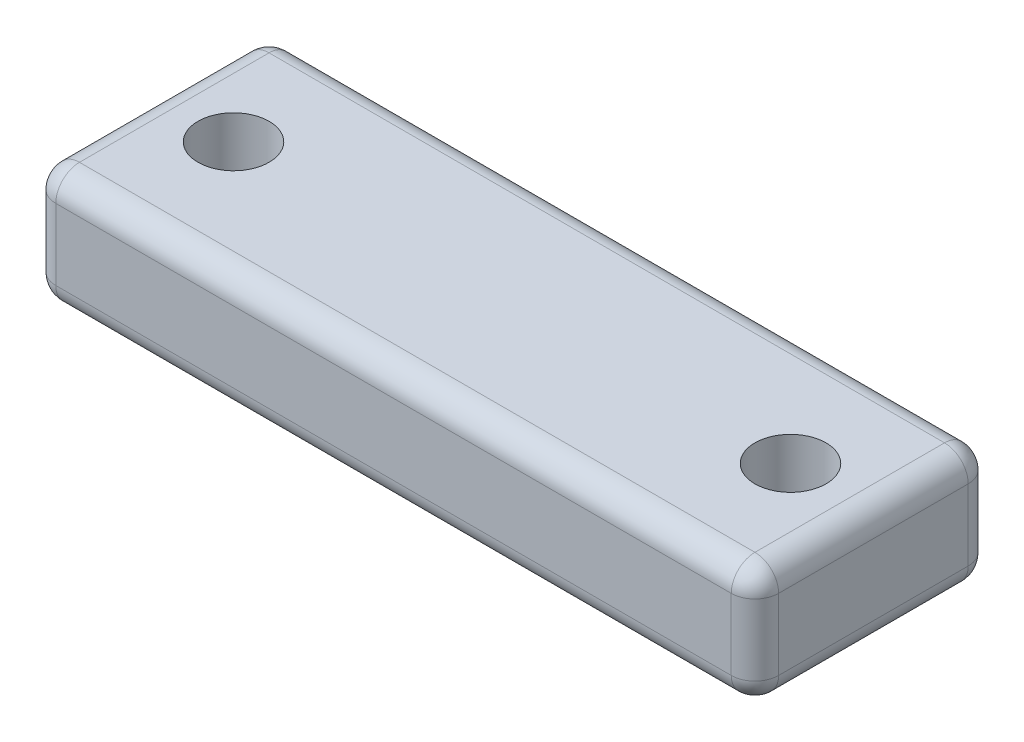
from build123d import *

# Parameters (mm, degrees)
SKETCH1_W               = 30.5
SKETCH1_H               = 10
BOSS_EXTRUDE1_DEPTH     = 5
CUT_EXTRUDE1_DEPTH      = 33.484611742
CUT_EXTRUDE1_DEPTH_BACK = 33.484611742
SKETCH2_R               = 1.5
FILLET1_R               = 1


with BuildPart() as part:
    # Sketch1 → Boss-Extrude1 (new body)
    with BuildSketch(Plane(origin=(0, 0, 0), x_dir=(1, 0, 0), z_dir=(0, 1, 0))):
        with Locations((-15.25, 5)):
            Rectangle(SKETCH1_W, SKETCH1_H)
    extrude(amount=BOSS_EXTRUDE1_DEPTH)

    # Sketch2 → Cut-Extrude1 (cut, two sides: drawn at the far end of the back side and taken through both)
    with BuildSketch(Plane(origin=(0, 5, 0), x_dir=(1, 0, 0), z_dir=(0, 1, 0)).offset(-CUT_EXTRUDE1_DEPTH_BACK)):
        with Locations(Location((-27, 5, 0), (0, 0, 270))):
            Circle(SKETCH2_R)
        with Locations(Location((-3.5, 5, 0), (0, 0, 270))):
            Circle(SKETCH2_R)
    extrude(amount=CUT_EXTRUDE1_DEPTH + CUT_EXTRUDE1_DEPTH_BACK, mode=Mode.SUBTRACT)

    # Fillet1
    fillet1_edges = [part.edges().sort_by_distance(p)[0] for p in [
        (-30.5, 5, -5),
        (-15.25, 5, 0),
        (0, 5, -5),
        (-15.25, 0, 0),
        (-30.5, 0, -5),
        (-15.25, 0, -10),
        (0, 0, -5),
        (0, 2.5, 0),
        (-30.5, 2.5, 0),
        (-30.5, 2.5, -10),
        (0, 2.5, -10),
        (-15.25, 5, -10),
    ]]
    fillet(fillet1_edges, radius=FILLET1_R)


solid = part.part
